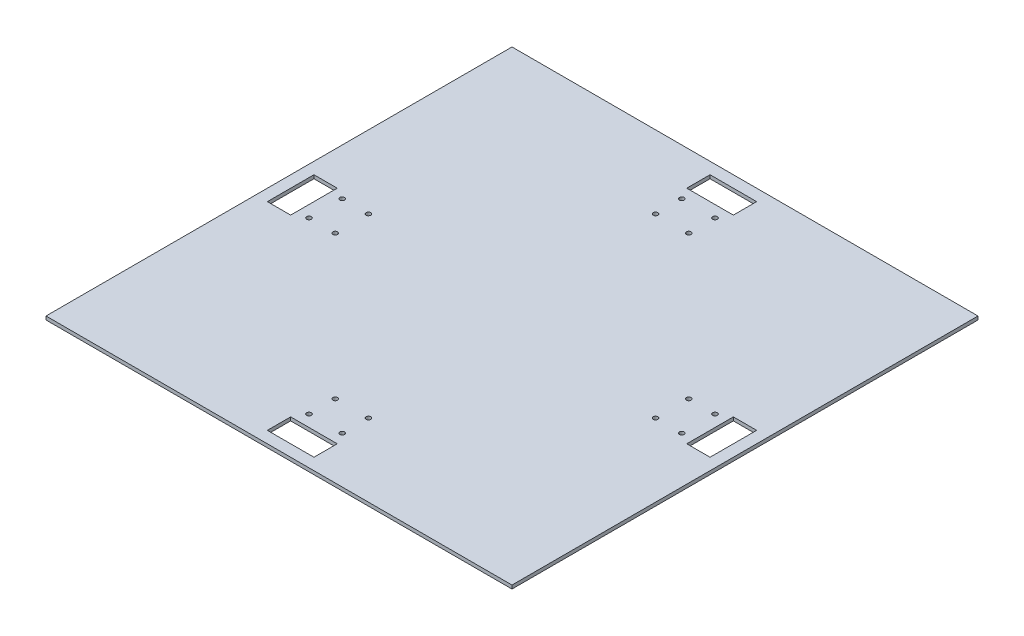
from build123d import *

# Parameters (mm, degrees)
SKETCH1_W      = 400
SKETCH1_H      = 400
SKETCH1_R      = 2
SKETCH1_W_2    = 20
SKETCH1_H_2    = 40
SKETCH1_W_3    = 40
SKETCH1_H_3    = 20
EXTRUDE1_DEPTH = 3


with BuildPart() as part:
    # Sketch1 → Extrude1 (new body)
    with BuildSketch(Plane(origin=(0, 0, 0), x_dir=(1, 0, 0), z_dir=(0, 1, 0))):
        with Locations((200, 200)):
            Rectangle(SKETCH1_W, SKETCH1_H)
        with Locations(Location((185.75, 40, 0), (0, 0, 270))):
            Circle(SKETCH1_R, mode=Mode.SUBTRACT)
        with Locations(Location((185.75, 62.5, 0), (0, 0, 270))):
            Circle(SKETCH1_R, mode=Mode.SUBTRACT)
        with Locations(Location((214.25, 62.5, 0), (0, 0, 90))):
            Circle(SKETCH1_R, mode=Mode.SUBTRACT)
        with Locations(Location((214.25, 40, 0), (0, 0, 90))):
            Circle(SKETCH1_R, mode=Mode.SUBTRACT)
        with Locations(Location((40, 214.25, 0), (0, 0, 270))):
            Circle(SKETCH1_R, mode=Mode.SUBTRACT)
        with Locations(Location((62.5, 214.25, 0), (0, 0, 270))):
            Circle(SKETCH1_R, mode=Mode.SUBTRACT)
        with Locations(Location((62.5, 185.75, 0), (0, 0, 90))):
            Circle(SKETCH1_R, mode=Mode.SUBTRACT)
        with Locations(Location((40, 185.75, 0), (0, 0, 90))):
            Circle(SKETCH1_R, mode=Mode.SUBTRACT)
        with Locations(Location((214.25, 360, 0), (0, 0, 270))):
            Circle(SKETCH1_R, mode=Mode.SUBTRACT)
        with Locations(Location((214.25, 337.5, 0), (0, 0, 270))):
            Circle(SKETCH1_R, mode=Mode.SUBTRACT)
        with Locations(Location((185.75, 337.5, 0), (0, 0, 90))):
            Circle(SKETCH1_R, mode=Mode.SUBTRACT)
        with Locations(Location((185.75, 360, 0), (0, 0, 90))):
            Circle(SKETCH1_R, mode=Mode.SUBTRACT)
        with Locations(Location((360, 185.75, 0), (0, 0, 270))):
            Circle(SKETCH1_R, mode=Mode.SUBTRACT)
        with Locations(Location((337.5, 185.75, 0), (0, 0, 270))):
            Circle(SKETCH1_R, mode=Mode.SUBTRACT)
        with Locations(Location((337.5, 214.25, 0), (0, 0, 90))):
            Circle(SKETCH1_R, mode=Mode.SUBTRACT)
        with Locations(Location((360, 214.25, 0), (0, 0, 90))):
            Circle(SKETCH1_R, mode=Mode.SUBTRACT)
        with Locations((20, 200)):
            Rectangle(SKETCH1_W_2, SKETCH1_H_2, mode=Mode.SUBTRACT)
        with Locations((200, 20)):
            Rectangle(SKETCH1_W_3, SKETCH1_H_3, mode=Mode.SUBTRACT)
        with Locations((200, 380)):
            Rectangle(SKETCH1_W_3, SKETCH1_H_3, mode=Mode.SUBTRACT)
        with Locations((380, 200)):
            Rectangle(SKETCH1_W_2, SKETCH1_H_2, mode=Mode.SUBTRACT)
    extrude(amount=EXTRUDE1_DEPTH)


solid = part.part
